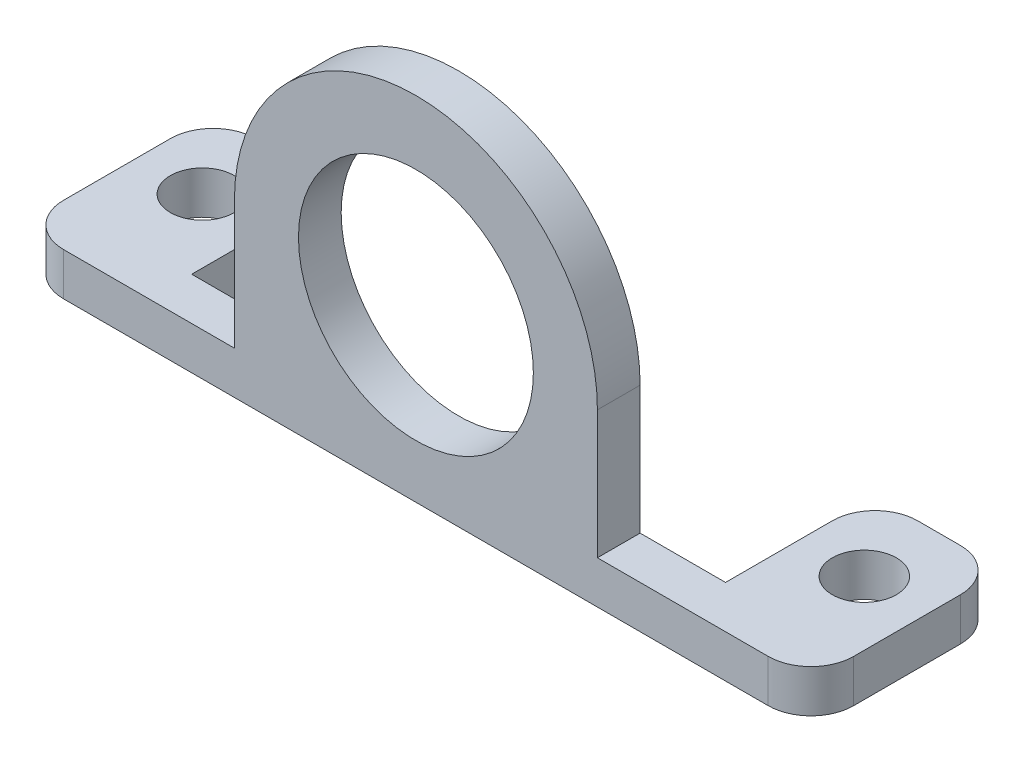
from build123d import *

# Parameters (mm, degrees)
SKETCH_1_R      = 1.5
EXTRUDE_1_DEPTH = 2
SKETCH_2_R      = 5.5
EXTRUDE_2_DEPTH = 2
FILLET_1_R      = 2


with BuildPart() as part:
    # 草图1 → 凸台-拉伸1 (new body)
    with BuildSketch(Plane(origin=(0, 0, 0), x_dir=(1, 0, 0), z_dir=(0, 1, 0))):
        Polygon((-12.5, -3.5), (12.5, -3.5), (12.5, 3.5), (18.5, 3.5), (18.5, -3.5), (18.5, -5.5), (-18.5, -5.5), (-18.5, -3.5), (-18.5, 3.5), (-12.5, 3.5), align=None)
        with Locations(Location((-15.5, 0, 0), (0, 0, 270))):
            Circle(SKETCH_1_R, mode=Mode.SUBTRACT)
        with Locations(Location((15.5, 0, 0), (0, 0, 90))):
            Circle(SKETCH_1_R, mode=Mode.SUBTRACT)
    extrude(amount=EXTRUDE_1_DEPTH)

    # 草图2 → 凸台-拉伸2 (add)
    with BuildSketch(Plane.XY.offset(5.5)):
        with BuildLine():
            Line((-8.5, 8), (-8.5, 0))
            Line((-8.5, 0), (8.5, 0))
            Line((8.5, 0), (8.5, 8))
            ThreePointArc((8.5, 8), (0, 16.5), (-8.5, 8))
        make_face()
        with Locations((0, 8)):
            Circle(SKETCH_2_R, mode=Mode.SUBTRACT)
    extrude(amount=-EXTRUDE_2_DEPTH)

    # 圆角1
    fillet_1_edges = [part.edges().sort_by_distance(p)[0] for p in [
        (12.5, 1, -3.5),
        (18.5, 1, -3.5),
        (18.5, 1, 5.5),
        (-18.5, 1, 5.5),
        (-18.5, 1, -3.5),
        (-12.5, 1, -3.5),
    ]]
    fillet(fillet_1_edges, radius=FILLET_1_R)


solid = part.part
